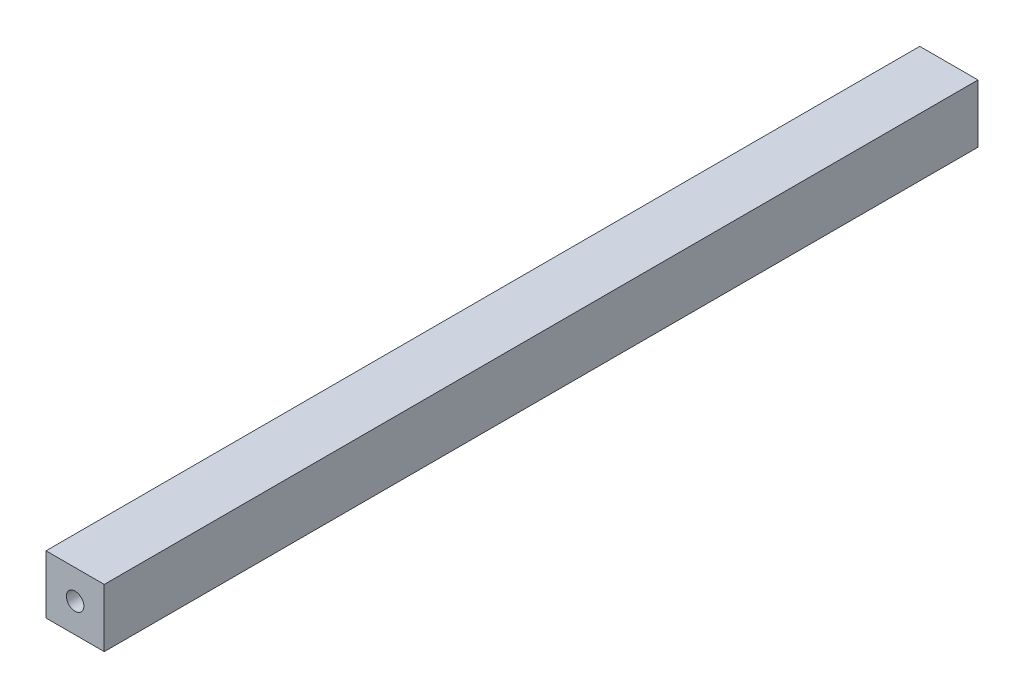
from build123d import *

# Parameters (mm, degrees)
ESQUISSE1_W             = 20
ESQUISSE1_H             = 20
BOSS_EXTRU_1_DEPTH      = 300
ESQUISSE2_R             = 3
ENL_V_MAT_EXTRU_1_DEPTH = 200
ENL_V_START             = -200
ESQUISSE3_R             = 3
ENL_V_MAT_EXTRU_2_DEPTH = 200


with BuildPart() as part:
    # Esquisse1 → Boss.-Extru.1 (new body)
    with BuildSketch(Plane.XY):
        Rectangle(ESQUISSE1_W, ESQUISSE1_H)
    extrude(amount=BOSS_EXTRU_1_DEPTH)

    # Esquisse2 → Enlèv. mat.-Extru.1 (cut)
    with BuildSketch(Plane.XY.offset(300)):
        Circle(ESQUISSE2_R)
    extrude(amount=-ENL_V_MAT_EXTRU_1_DEPTH, mode=Mode.SUBTRACT)

    # Esquisse3 → Enlèv. mat.-Extru.2 (cut)
    with BuildSketch(Plane(origin=(0, 0, 0), x_dir=(-1, 0, 0), z_dir=(0, 0, -1)).offset(ENL_V_START)):
        with Locations(Location((0, 0, 0), (0, 0, 180))):
            Circle(ESQUISSE3_R)
    extrude(amount=ENL_V_MAT_EXTRU_2_DEPTH, mode=Mode.SUBTRACT)


solid = part.part
